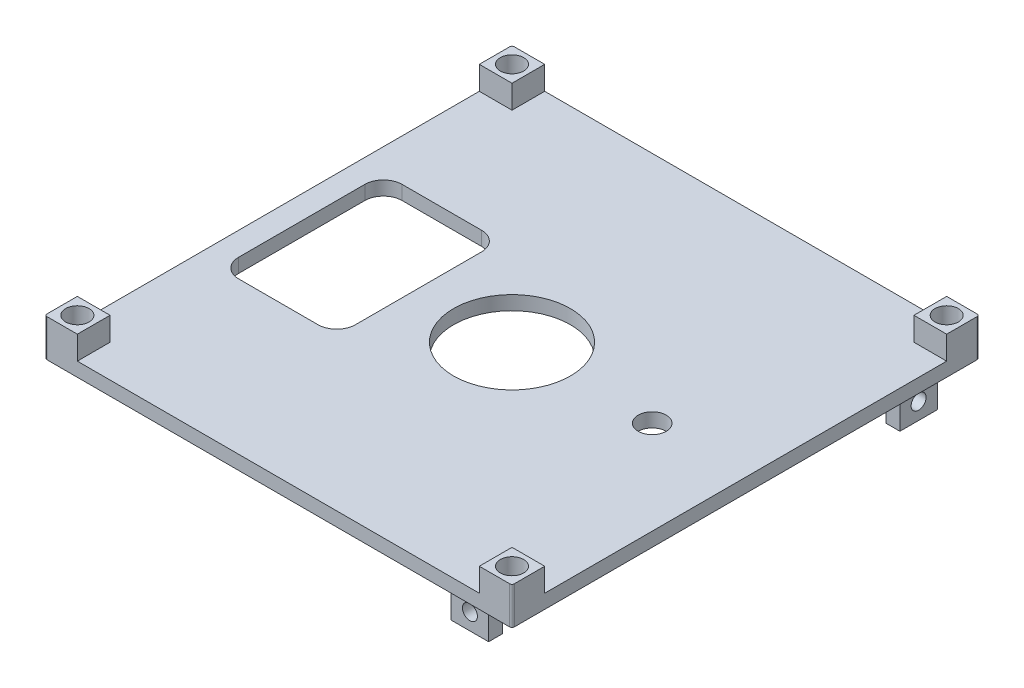
from build123d import *

# Parameters (mm, degrees)
SKETCH2_W           = 100
SKETCH2_H           = 100
SKETCH2_R           = 12.5
BOSS_EXTRUDE1_DEPTH = 3
SKETCH3_W           = 7
SKETCH3_H           = 7
BOSS_EXTRUDE2_DEPTH = 5
SKETCH4_W           = 3
SKETCH4_H           = 8
SKETCH4_W_2         = 8
SKETCH4_H_2         = 3
BOSS_EXTRUDE3_DEPTH = 7
SKETCH11_R          = 2.5
CUT_EXTRUDE6_DEPTH  = 73.284161474
SKETCH5_R           = 1.6
CUT_EXTRUDE1_DEPTH  = 113.089250154
SKETCH7_R           = 3
CUT_EXTRUDE3_DEPTH  = 10
SKETCH8_R           = 1.6
SKETCH8_R_2         = 1.5
CUT_EXTRUDE4_DEPTH  = 111.308657865
FILLET1_R           = 0.5
CUT_EXTRUDE5_DEPTH  = 10


with BuildPart() as part:
    # Sketch2 → Boss-Extrude1 (new body)
    with BuildSketch(Plane(origin=(0, 0, 0), x_dir=(1, 0, 0), z_dir=(0, 1, 0))):
        Rectangle(SKETCH2_W, SKETCH2_H)
        with Locations(Location((0, 0, 0), (0, 0, 270))):
            Circle(SKETCH2_R, mode=Mode.SUBTRACT)
    extrude(amount=BOSS_EXTRUDE1_DEPTH)

    # Sketch3 → Boss-Extrude2 (add)
    with BuildSketch(Plane(origin=(0, 3, 0), x_dir=(1, 0, 0), z_dir=(0, 1, 0))):
        with Locations((-46.5, 46.5)):
            Rectangle(SKETCH3_W, SKETCH3_H)
        with Locations((46.5, 46.5)):
            Rectangle(SKETCH3_W, SKETCH3_H)
        with Locations((46.5, -46.5)):
            Rectangle(SKETCH3_W, SKETCH3_H)
        with Locations((-46.5, -46.5)):
            Rectangle(SKETCH3_W, SKETCH3_H)
    extrude(amount=BOSS_EXTRUDE2_DEPTH)

    # Sketch4 → Boss-Extrude3 (add)
    with BuildSketch(Plane.XZ):
        with Locations((46.5, -39)):
            Rectangle(SKETCH4_W, SKETCH4_H)
        with Locations((39, 46.5)):
            Rectangle(SKETCH4_W_2, SKETCH4_H_2)
        with Locations((-46.5, 39)):
            Rectangle(SKETCH4_W, SKETCH4_H)
        with Locations((-39, -46.5)):
            Rectangle(SKETCH4_W_2, SKETCH4_H_2)
    extrude(amount=BOSS_EXTRUDE3_DEPTH)

    # Sketch11 → Cut-Extrude6 (cut, through all)
    with BuildSketch(Plane(origin=(0, 8, 0), x_dir=(1, 0, 0), z_dir=(0, 1, 0))):
        with Locations(Location((-46.5, 46.5, 0), (0, 0, 270))):
            Circle(SKETCH11_R)
        with Locations(Location((46.5, 46.5, 0), (0, 0, 270))):
            Circle(SKETCH11_R)
        with Locations(Location((46.5, -46.5, 0), (0, 0, 270))):
            Circle(SKETCH11_R)
        with Locations(Location((-46.5, -46.5, 0), (0, 0, 270))):
            Circle(SKETCH11_R)
    extrude(amount=-CUT_EXTRUDE6_DEPTH, mode=Mode.SUBTRACT)

    # Sketch5 → Cut-Extrude1 (cut, through all)
    with BuildSketch(Plane(origin=(0, 0, 50), x_dir=(-1, 0, 0), z_dir=(0, 0, -1))):
        with Locations(Location((-39, -3.5, 0), (0, 0, 180))):
            Circle(SKETCH5_R)
        with Locations(Location((39, -3.5, 0), (0, 0, 180))):
            Circle(SKETCH5_R)
    extrude(amount=CUT_EXTRUDE1_DEPTH, mode=Mode.SUBTRACT)

    # Sketch7 → Cut-Extrude3 (cut)
    with BuildSketch(Plane.XZ):
        with Locations(Location((30, 0, 0), (0, 0, 270))):
            Circle(SKETCH7_R)
    extrude(amount=-CUT_EXTRUDE3_DEPTH, mode=Mode.SUBTRACT)

    # Sketch8 → Cut-Extrude4 (cut, through all)
    with BuildSketch(Plane(origin=(48, 0, 0), x_dir=(0, 0, -1), z_dir=(1, 0, 0))):
        with Locations((39, -3.5)):
            Circle(SKETCH8_R)
        with Locations(Location((-39, -3.5, 0), (0, 0, 180))):
            Circle(SKETCH8_R_2)
    extrude(amount=-CUT_EXTRUDE4_DEPTH, mode=Mode.SUBTRACT)

    # Fillet1
    fillet1_edges = [part.edges().sort_by_distance(p)[0] for p in [
        (-50, 4, 50),
        (-50, 4, -50),
        (50, 4, -50),
        (50, 4, 50),
    ]]
    fillet(fillet1_edges, radius=FILLET1_R)

    # Sketch9 → Cut-Extrude5 (cut)
    with BuildSketch(Plane(origin=(0, 3, 0), x_dir=(1, 0, 0), z_dir=(0, 1, 0))):
        with BuildLine():
            Line((-41, 17.5), (-24, 17.5))
            ThreePointArc((-24, 17.5), (-21.171572875, 16.328427125), (-20, 13.5))
            Line((-20, 13.5), (-20, -13.5))
            ThreePointArc((-20, -13.5), (-21.171572875, -16.328427125), (-24, -17.5))
            Line((-24, -17.5), (-41, -17.5))
            ThreePointArc((-41, -17.5), (-43.828427125, -16.328427125), (-45, -13.5))
            Line((-45, -13.5), (-45, 13.5))
            ThreePointArc((-45, 13.5), (-43.828427125, 16.328427125), (-41, 17.5))
        make_face()
    extrude(amount=-CUT_EXTRUDE5_DEPTH, mode=Mode.SUBTRACT)


solid = part.part
